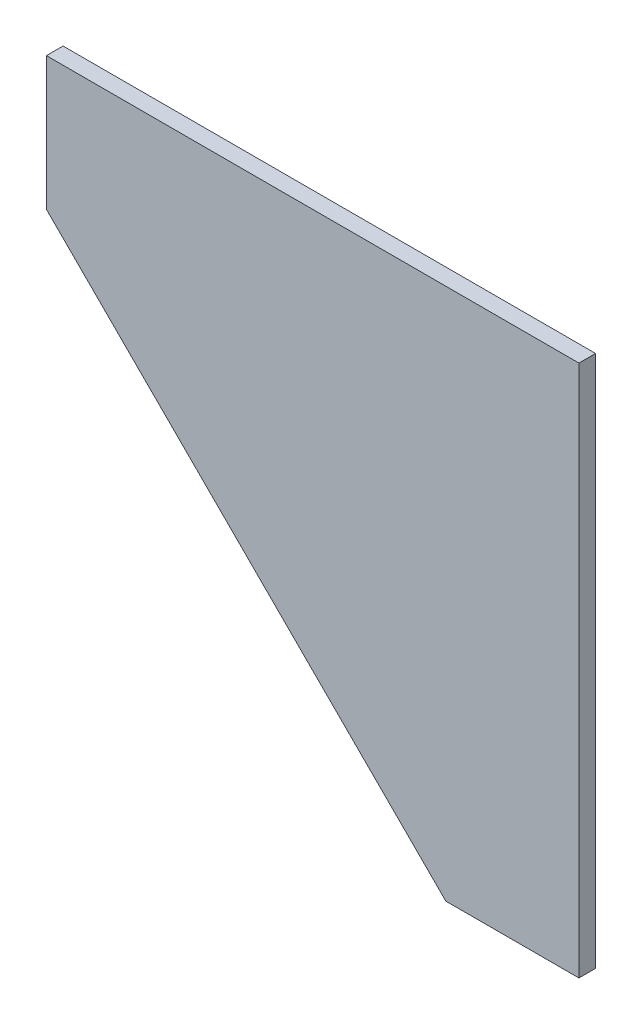
from build123d import *

# Parameters (mm, degrees)
BOSS_EXTRUDE1_DEPTH = 6.35


with BuildPart() as part:
    # Sketch1 → Boss-Extrude1 (new body)
    with BuildSketch(Plane.XY):
        Polygon((0, 0), (0, 203.2), (-203.2, 203.2), (-203.2, 152.4), (-50.8, 0), align=None)
    extrude(amount=BOSS_EXTRUDE1_DEPTH)


solid = part.part
